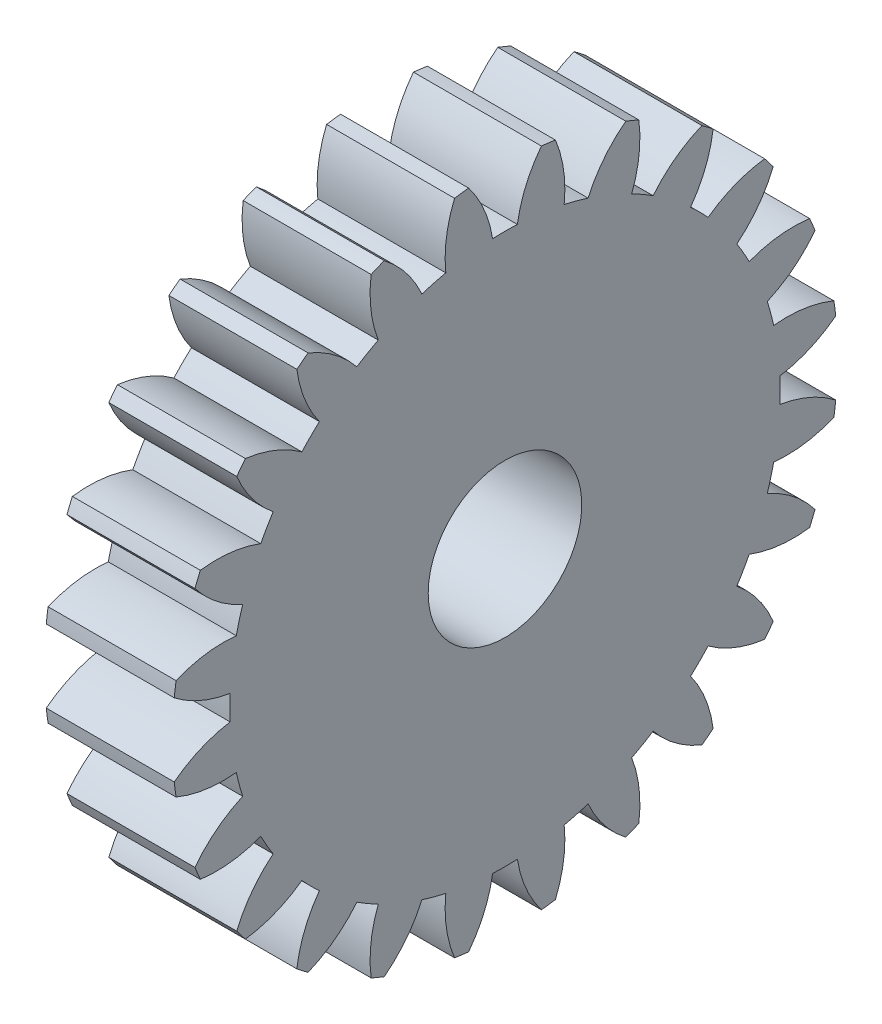
from build123d import *

# Parameters (mm, degrees)
BASPROSKE_W     = 5
BASPROSKE_H     = 13
TOOTHCUT_DEPTH  = 20.052558883
TEETHCUTS_COUNT = 24
TEETHCUTS_ANGLE = 345
BORSKE_R        = 3
BORE_DEPTH      = 50.0000508


with BuildPart() as part:
    # BasProSke → Base-Revolve (revolve)
    with BuildSketch(Plane(origin=(0, 0, 0), x_dir=(1, 0, 0), z_dir=(0, 1, 0)), mode=Mode.PRIVATE) as base_revolve_sk:
        with Locations((2.5, 6.5)):
            Rectangle(BASPROSKE_W, BASPROSKE_H)
    revolve(base_revolve_sk.sketch.rotate(Axis((-10, 0, 0), (1, 0, 0)), 180), axis=Axis((-10, 0, 0), (1, 0, 0)))

    # TooCutSke → ToothCut (cut, through all)
    with BuildSketch(Plane(origin=(0, 0, 0), x_dir=(0, 0, -1), z_dir=(1, 0, 0))):
        with BuildLine():
            ThreePointArc((0.483448384, 10.738122679), (0, 10.749), (-0.483448384, 10.738122679))
            ThreePointArc((-0.483448384, 10.738122679), (-0.821636462, 11.902754369), (-1.44092227, 12.945454344))
            ThreePointArc((-1.44092227, 12.945454344), (0, 13.0254), (1.44092227, 12.945454344))
            ThreePointArc((1.44092227, 12.945454344), (0.821636462, 11.902754369), (0.483448384, 10.738122679))
        make_face()
    toothcut = extrude(amount=TOOTHCUT_DEPTH, mode=Mode.SUBTRACT)

    # TeethCuts: ToothCut ×24 about axis
    teethcuts_axis = Axis((-10, 0, 0), (1, 0, 0))
    for i in range(1, TEETHCUTS_COUNT):
        add(toothcut.rotate(teethcuts_axis, i * TEETHCUTS_ANGLE / (TEETHCUTS_COUNT - 1)), mode=Mode.SUBTRACT)

    # BorSke → Bore (cut, symmetric)
    with BuildSketch(Plane(origin=(0, 0, 0), x_dir=(0, 0, -1), z_dir=(1, 0, 0))):
        with Locations(Location((0, 0, 0), (0, 0, 180))):
            Circle(BORSKE_R)
    extrude(amount=BORE_DEPTH, both=True, mode=Mode.SUBTRACT)


solid = part.part
